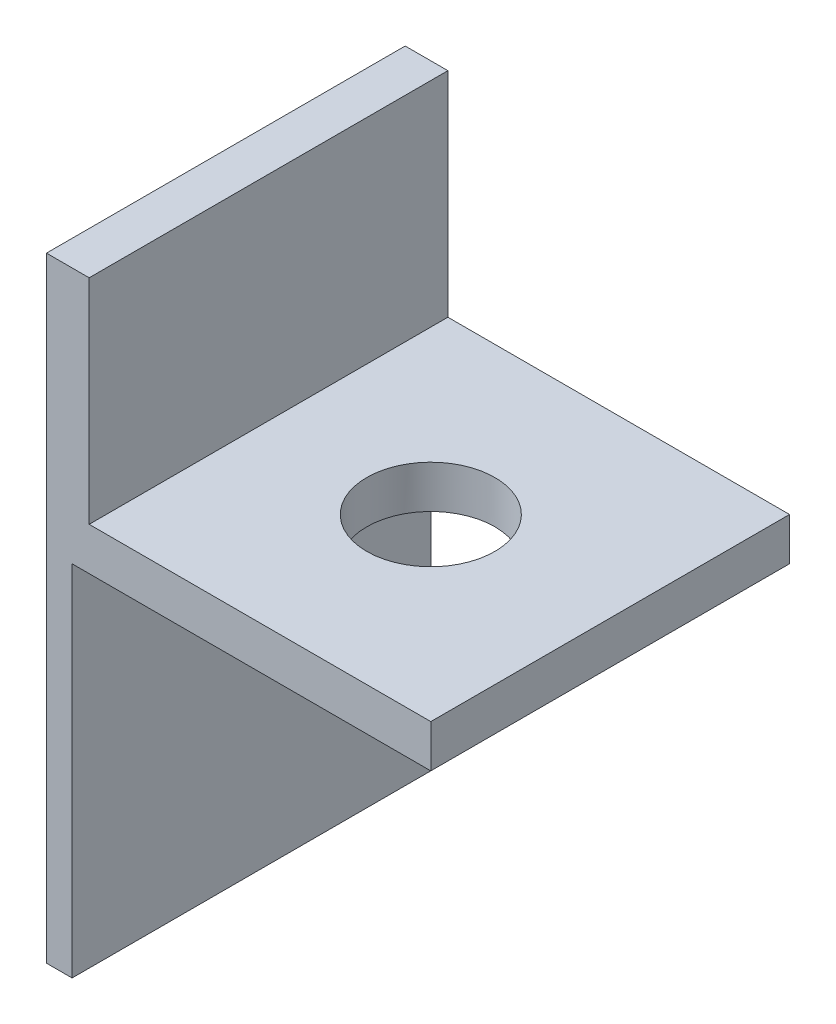
from build123d import *

# Parameters (mm, degrees)
SKETCH_1_W          = 42
SKETCH_1_H          = 42
EXTRUDE_1_DEPTH     = 5
SKETCH_2_W          = 42
SKETCH_2_H          = 5
EXTRUDE_2_DEPTH     = 3
SKETCH_4_W          = 5
SKETCH_4_H          = 42
EXTRUDE_3_DEPTH     = 25
SKETCH_5_W          = 3
SKETCH_5_H          = 42
EXTRUDE_4_DEPTH     = 42
SKETCH_8_R          = 7.5
CUT_EXTRUDE_1_DEPTH = 25


with BuildPart() as part:
    # 草图1 → 凸台-拉伸1 (new body)
    with BuildSketch(Plane(origin=(0, 0, 0), x_dir=(1, 0, 0), z_dir=(0, 1, 0))):
        Rectangle(SKETCH_1_W, SKETCH_1_H)
    extrude(amount=EXTRUDE_1_DEPTH)

    # 草图2 → 凸台-拉伸2 (add)
    with BuildSketch(Plane.ZY.offset(21)):
        with Locations((0, 2.5)):
            Rectangle(SKETCH_2_W, SKETCH_2_H)
    extrude(amount=EXTRUDE_2_DEPTH)

    # 草图4 → 凸台-拉伸3 (add)
    with BuildSketch(Plane(origin=(0, 5, 0), x_dir=(1, 0, 0), z_dir=(0, 1, 0))):
        with Locations((-21.5, 0)):
            Rectangle(SKETCH_4_W, SKETCH_4_H)
    extrude(amount=EXTRUDE_3_DEPTH)

    # 草图5 → 凸台-拉伸4 (add)
    with BuildSketch(Plane.XZ):
        with Locations((-22.5, 0)):
            Rectangle(SKETCH_5_W, SKETCH_5_H)
    extrude(amount=EXTRUDE_4_DEPTH)

    # 草图8 → 切除-拉伸1 (cut)
    with BuildSketch(Plane(origin=(0, 5, 0), x_dir=(1, 0, 0), z_dir=(0, 1, 0))):
        with Locations(Location((0, 0, 0), (0, 0, 270))):
            Circle(SKETCH_8_R)
    extrude(amount=-CUT_EXTRUDE_1_DEPTH, mode=Mode.SUBTRACT)


solid = part.part
